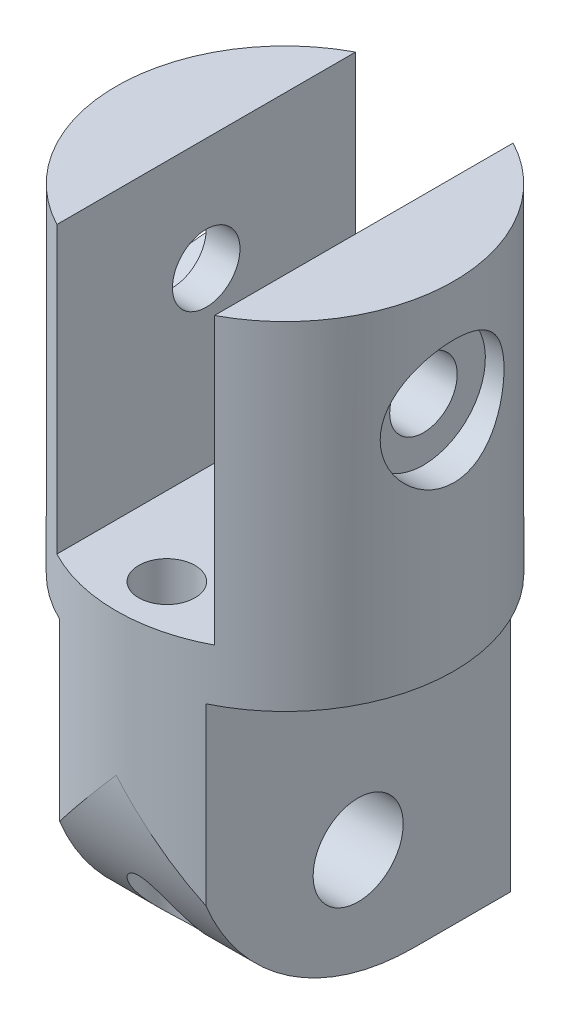
from build123d import *

# Parameters (mm, degrees)
SKETCH1_W           = 6.5
SKETCH1_H           = 14
BOSS_EXTRUDE1_DEPTH = 15
FILLET1_R           = 10
SKETCH2_R           = 2
CUT_EXTRUDE1_DEPTH  = 18.783419244
SKETCH4_R           = 7.5
BOSS_EXTRUDE2_DEPTH = 15
SKETCH6_W           = 7
SKETCH6_H           = 12.68
CUT_EXTRUDE2_DEPTH  = 28.663152387
CUT_EXTRUDE3_DEPTH  = 23.5
SKETCH8_R           = 1.5
CUT_EXTRUDE4_DEPTH  = 21
SKETCH9_R           = 2.75
CUT_EXTRUDE5_DEPTH  = 10
CUT_EXTRUDE6_DEPTH  = 10
SKETCH11_R          = 1.25
CUT_EXTRUDE7_DEPTH  = 24


with BuildPart() as part:
    # Sketch1 → Boss-Extrude1 (new body)
    with BuildSketch(Plane.XY):
        Rectangle(SKETCH1_W, SKETCH1_H)
    extrude(amount=BOSS_EXTRUDE1_DEPTH)

    # Fillet1
    fillet1_edges = [part.edges().sort_by_distance(p)[0] for p in [
        (0, -7, 15),
    ]]
    fillet(fillet1_edges, radius=FILLET1_R)

    # Sketch2 → Cut-Extrude1 (cut, through all)
    with BuildSketch(Plane(origin=(3.25, 0, 0), x_dir=(0, 0, -1), z_dir=(1, 0, 0))):
        with Locations((-7.5, -2)):
            Circle(SKETCH2_R)
    extrude(amount=-CUT_EXTRUDE1_DEPTH, mode=Mode.SUBTRACT)

    # Sketch4 → Boss-Extrude2 (add)
    with BuildSketch(Plane(origin=(0, 7, 0), x_dir=(1, 0, 0), z_dir=(0, 1, 0))):
        with Locations((0, -7.5)):
            Circle(SKETCH4_R)
    extrude(amount=BOSS_EXTRUDE2_DEPTH)

    # Sketch6 → Cut-Extrude2 (cut, through all)
    with BuildSketch(Plane(origin=(0, 0, 0), x_dir=(-1, 0, 0), z_dir=(0, 0, -1))):
        with Locations((0, 15.66)):
            Rectangle(SKETCH6_W, SKETCH6_H)
    extrude(amount=-CUT_EXTRUDE2_DEPTH, mode=Mode.SUBTRACT)

    # Sketch7 → Cut-Extrude3 (cut, through all)
    with BuildSketch(Plane(origin=(0, 7, 0), x_dir=(1, 0, 0), z_dir=(0, 1, 0))):
        with BuildLine():
            ThreePointArc((0, -15), (-1.666673801, -14.812468697), (-3.25, -14.259252917))
            Line((-3.25, -14.259252917), (-3.25, -15))
            Line((-3.25, -15), (0, -15))
        make_face()
        with BuildLine():
            ThreePointArc((3.25, -14.259252917), (1.666673801, -14.812468697), (0, -15))
            Line((0, -15), (3.25, -15))
            Line((3.25, -15), (3.25, -14.259252917))
        make_face()
        with BuildLine():
            ThreePointArc((-3.25, -0.740747083), (-1.666673801, -0.187531303), (0, 0))
            Line((0, 0), (-3.25, 0))
            Line((-3.25, 0), (-3.25, -0.740747083))
        make_face()
        with BuildLine():
            Line((3.25, 0), (0, 0))
            ThreePointArc((0, 0), (1.666673801, -0.187531303), (3.25, -0.740747083))
            Line((3.25, -0.740747083), (3.25, 0))
        make_face()
    extrude(amount=-CUT_EXTRUDE3_DEPTH, mode=Mode.SUBTRACT)

    # Sketch8 → Cut-Extrude4 (cut, symmetric)
    with BuildSketch(Plane(origin=(-3.5, 0, 0), x_dir=(0, 0, -1), z_dir=(1, 0, 0))):
        with Locations((-7.5, 17)):
            Circle(SKETCH8_R)
    extrude(amount=CUT_EXTRUDE4_DEPTH, both=True, mode=Mode.SUBTRACT)

    # Sketch9 → Cut-Extrude5 (cut)
    with BuildSketch(Plane.ZY.offset(-6.15)):
        with Locations((7.5, 17)):
            Circle(SKETCH9_R)
    extrude(amount=-CUT_EXTRUDE5_DEPTH, mode=Mode.SUBTRACT)

    # Sketch10 → Cut-Extrude6 (cut)
    with BuildSketch(Plane(origin=(-5, 0, 0), x_dir=(0, 0, -1), z_dir=(1, 0, 0))):
        Polygon((-7.5, 20.75277675), (-10.75, 18.876388375), (-10.75, 15.123611625), (-7.5, 13.24722325), (-4.25, 15.123611625), (-4.25, 18.876388375), align=None)
    extrude(amount=-CUT_EXTRUDE6_DEPTH, mode=Mode.SUBTRACT)

    # Sketch11 → Cut-Extrude7 (cut)
    with BuildSketch(Plane.XZ.offset(7)):
        with Locations((0, 3)):
            Circle(SKETCH11_R)
        with Locations((0, 12.74882624)):
            Circle(SKETCH11_R)
    extrude(amount=-CUT_EXTRUDE7_DEPTH, mode=Mode.SUBTRACT)


solid = part.part
